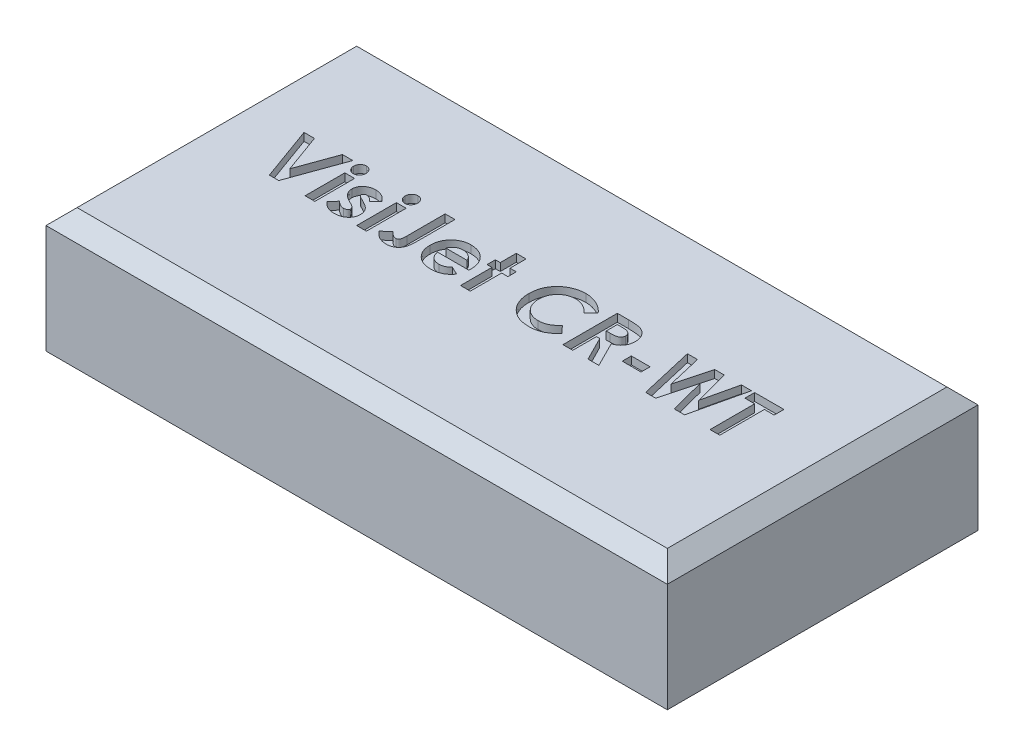
from build123d import *

# Parameters (mm, degrees)
SKETCH1_W           = 40
SKETCH1_H           = 20
BOSS_EXTRUDE1_DEPTH = 8
CHAMFER1_SIZE       = 1
SKETCH2_W           = 0.628205129
SKETCH2_H           = 2.557692308
SKETCH2_W_2         = 0.628205128
SKETCH2_W_3         = 1.211538462
SKETCH2_H_2         = 0.583333333
CUT_EXTRUDE1_DEPTH  = 0.5


with BuildPart() as part:
    # Sketch1 → Boss-Extrude1 (new body)
    with BuildSketch(Plane(origin=(0, 0, 0), x_dir=(1, 0, 0), z_dir=(0, 1, 0))):
        with Locations((0, 2.318501171)):
            Rectangle(SKETCH1_W, SKETCH1_H)
    extrude(amount=BOSS_EXTRUDE1_DEPTH)

    # Chamfer1
    chamfer1_edges = [part.edges().sort_by_distance(p)[0] for p in [
        (-20, 8, -2.318501171),
        (0, 8, 7.681498829),
        (20, 8, -2.318501171),
        (0, 8, -12.318501171),
    ]]
    chamfer(chamfer1_edges, length=CHAMFER1_SIZE)

    # Sketch2 → Cut-Extrude1 (cut)
    # profile 1 of 14: a face of its own
    with BuildSketch(Plane(origin=(0, 8, 0), x_dir=(1, 0, 0), z_dir=(0, 1, 0))):
        Polygon((-15.887820513, 4.818501171), (-15.216846955, 4.818501171), (-14.317307692, 2.332323286), (-13.415665064, 4.818501171), (-12.746794872, 4.818501171), (-14.015825321, 1.318501171), (-14.620893429, 1.318501171), align=None)
    # profile 2 of 14: a face of its own
    with BuildSketch(Plane(origin=(0, 8, 0), x_dir=(1, 0, 0), z_dir=(0, 1, 0))):
        with BuildLine():
            add(Edge.make_bspline(
                [(-12.0078125, 4.953116556), (-11.980736863, 4.951788122), (-11.927571242, 4.949179616), (-11.851404255, 4.923752479), (-11.781498398, 4.883845348), (-11.719699681, 4.829091813), (-11.668301287, 4.763706077), (-11.629031005, 4.690502399), (-11.607155167, 4.609395081), (-11.604116937, 4.553366994), (-11.602564103, 4.524731139)],
                knots=[0, 0, 0, 0, 0.989868614, 1.943702388, 2.910836514, 3.924849579, 4.949916355, 5.946401046, 6.950409252, 8, 8, 8, 8], degree=3))
            add(Edge.make_bspline(
                [(-11.602564103, 4.524731139), (-11.604061379, 4.496306314), (-11.606978893, 4.440919191), (-11.629534491, 4.360912942), (-11.6672286, 4.287744819), (-11.719043289, 4.223330183), (-11.780172027, 4.169458486), (-11.848550388, 4.128826865), (-11.923987474, 4.104814234), (-11.976328126, 4.101987671), (-12.002904647, 4.100552453)],
                knots=[0, 0, 0, 0, 1.05296456, 2.051751585, 3.055639087, 4.085634717, 5.099016424, 6.062201612, 7.016062274, 8, 8, 8, 8], degree=3))
            add(Edge.make_bspline(
                [(-12.002904647, 4.100552453), (-12.030216632, 4.101876137), (-12.083844792, 4.104475244), (-12.160636505, 4.129961874), (-12.231474728, 4.169554711), (-12.293005362, 4.225426946), (-12.344992383, 4.291277296), (-12.382547323, 4.36618522), (-12.406038867, 4.447847148), (-12.408827293, 4.504705048), (-12.41025641, 4.533845722)],
                knots=[0, 0, 0, 0, 0.989065327, 1.942068821, 2.907541208, 3.917690034, 4.939857478, 5.938239964, 6.943311734, 8, 8, 8, 8], degree=3))
            add(Edge.make_bspline(
                [(-12.41025641, 4.533845722), (-12.40870114, 4.561787876), (-12.405646036, 4.616676204), (-12.383639159, 4.695980268), (-12.345269344, 4.767953278), (-12.294241178, 4.832142067), (-12.232985262, 4.885874243), (-12.163121369, 4.924569368), (-12.087466989, 4.948946292), (-12.034638153, 4.951712114), (-12.0078125, 4.953116556)],
                knots=[0, 0, 0, 0, 1.038616768, 2.040212704, 3.031499824, 4.052181184, 5.074969369, 6.039807101, 7.004644834, 8, 8, 8, 8], degree=3))
        make_face()
    # profile 3 of 14: a face of its own
    with BuildSketch(Plane(origin=(0, 8, 0), x_dir=(1, 0, 0), z_dir=(0, 1, 0))):
        with Locations((-12.006410257, 2.597347325)):
            Rectangle(SKETCH2_W, SKETCH2_H)
    # profile 4 of 14: a face of its own
    with BuildSketch(Plane(origin=(0, 8, 0), x_dir=(1, 0, 0), z_dir=(0, 1, 0))):
        with BuildLine():
            Line((-9.538461538, 3.481461908), (-9.922676282, 3.068501171))
            add(Edge.make_bspline(
                [(-9.922676282, 3.068501171), (-9.941861965, 3.089731169), (-9.978556908, 3.130336114), (-10.03473332, 3.185689728), (-10.090073156, 3.231782937), (-10.143545162, 3.270503154), (-10.196241427, 3.300196932), (-10.247723927, 3.32156094), (-10.298017364, 3.33512313), (-10.33135398, 3.336878704), (-10.34755609, 3.33773194)],
                knots=[0, 0, 0, 0, 1.327646587, 2.539285, 3.655602211, 4.666613517, 5.598770349, 6.454635452, 7.248928967, 8, 8, 8, 8], degree=3))
            add(Edge.make_bspline(
                [(-10.34755609, 3.33773194), (-10.363950998, 3.33723228), (-10.395342146, 3.336275585), (-10.439642091, 3.328069544), (-10.478562556, 3.313863375), (-10.511496163, 3.294499043), (-10.537955605, 3.270644174), (-10.556481095, 3.243354767), (-10.568921132, 3.213479587), (-10.569973478, 3.192258092), (-10.570512821, 3.18138178)],
                knots=[0, 0, 0, 0, 1.295068245, 2.479652818, 3.543291146, 4.55379989, 5.481948265, 6.332409746, 7.145336708, 8, 8, 8, 8], degree=3))
            add(Edge.make_bspline(
                [(-10.570512821, 3.18138178), (-10.568685479, 3.164899466), (-10.564893959, 3.130700579), (-10.53885147, 3.091034972), (-10.504395376, 3.061774466), (-10.464677463, 3.034545884), (-10.410889127, 3.004101415), (-10.37008393, 2.983255198), (-10.34755609, 2.971746363)],
                knots=[0, 0, 0, 0, 0.916701701, 1.902049539, 2.5493345, 3.440293453, 4.586830489, 6, 6, 6, 6], degree=3))
            Line((-10.34755609, 2.971746363), (-10.120392628, 2.856762389))
            add(Edge.make_bspline(
                [(-10.120392628, 2.856762389), (-10.091493092, 2.842088143), (-10.035422565, 2.813617351), (-9.956592655, 2.767675903), (-9.883784094, 2.723146153), (-9.818457399, 2.677509175), (-9.76021273, 2.631557834), (-9.709463796, 2.584837732), (-9.664979678, 2.538829986), (-9.615373643, 2.477146177), (-9.56575272, 2.394988362), (-9.524384281, 2.288145952), (-9.498004131, 2.173741222), (-9.495085471, 2.094557347), (-9.493589744, 2.053977934)],
                knots=[0, 0, 0, 0, 1.076693506, 2.088987655, 3.030641824, 3.911722491, 4.735175175, 5.493635918, 6.202154166, 6.859459289, 8.120623445, 9.372284821, 10.653373066, 12, 12, 12, 12], degree=3))
            add(Edge.make_bspline(
                [(-9.493589744, 2.053977934), (-9.494490929, 2.026601336), (-9.496254788, 1.97301807), (-9.507405532, 1.89414861), (-9.527435157, 1.81915543), (-9.553794113, 1.746869538), (-9.589298837, 1.678598082), (-9.632403311, 1.614010106), (-9.6824269, 1.552257605), (-9.740692049, 1.495453011), (-9.804520546, 1.442511751), (-9.875476691, 1.39798435), (-9.950423114, 1.35883453), (-10.031339779, 1.328262007), (-10.117091324, 1.303475813), (-10.208412819, 1.286299602), (-10.30499439, 1.275490172), (-10.371130531, 1.274260174), (-10.405048077, 1.273629376)],
                knots=[0, 0, 0, 0, 0.976600749, 1.911466839, 2.833459288, 3.740827163, 4.650527853, 5.570709661, 6.506801416, 7.479409329, 8.468875524, 9.458587492, 10.461481786, 11.480119772, 12.538142914, 13.641687514, 14.790552763, 16, 16, 16, 16], degree=3))
            add(Edge.make_bspline(
                [(-10.405048077, 1.273629376), (-10.449985913, 1.275060396), (-10.538194928, 1.277869364), (-10.66701781, 1.297436227), (-10.788660809, 1.331306797), (-10.903224006, 1.378755132), (-11.011409084, 1.43921732), (-11.111671038, 1.514237659), (-11.205748001, 1.601861553), (-11.260482956, 1.669064999), (-11.288461538, 1.703417036)],
                knots=[0, 0, 0, 0, 1.056901255, 2.07460411, 3.05625841, 4.019970729, 4.984811261, 5.963335951, 6.958928997, 8, 8, 8, 8], degree=3))
            Line((-11.288461538, 1.703417036), (-10.907752404, 2.126193479))
            add(Edge.make_bspline(
                [(-10.907752404, 2.126193479), (-10.889202969, 2.106628595), (-10.852376275, 2.067785903), (-10.790301349, 2.016566561), (-10.724621682, 1.969883899), (-10.654606101, 1.930685695), (-10.584576372, 1.899034909), (-10.517388626, 1.875292392), (-10.454309088, 1.860371823), (-10.413296399, 1.858059996), (-10.393830128, 1.856962709)],
                knots=[0, 0, 0, 0, 1.087861918, 2.159761696, 3.243809206, 4.338405912, 5.394481878, 6.343674753, 7.213841449, 8, 8, 8, 8], degree=3))
            add(Edge.make_bspline(
                [(-10.393830128, 1.856962709), (-10.374374394, 1.857526161), (-10.336975103, 1.858609269), (-10.283821027, 1.869875723), (-10.23670812, 1.888816297), (-10.196754621, 1.915077883), (-10.16352237, 1.945222173), (-10.140106619, 1.979481335), (-10.124622886, 2.015809087), (-10.122741019, 2.041208069), (-10.121794872, 2.053977934)],
                knots=[0, 0, 0, 0, 1.255011871, 2.412479185, 3.488767498, 4.514443302, 5.48617286, 6.365347346, 7.178144445, 8, 8, 8, 8], degree=3))
            add(Edge.make_bspline(
                [(-10.121794872, 2.053977934), (-10.122639116, 2.06600345), (-10.124372512, 2.090694154), (-10.138095863, 2.127139399), (-10.159641794, 2.163226039), (-10.189524825, 2.199055819), (-10.228142587, 2.234338023), (-10.275356878, 2.268790052), (-10.330078462, 2.304249964), (-10.370498939, 2.325414783), (-10.391726763, 2.336530017)],
                knots=[0, 0, 0, 0, 0.704666567, 1.446816302, 2.258757648, 3.165368109, 4.175243826, 5.322435858, 6.59381024, 8, 8, 8, 8], degree=3))
            Line((-10.391726763, 2.336530017), (-10.599959936, 2.441698286))
            add(Edge.make_bspline(
                [(-10.599959936, 2.441698286), (-10.647195532, 2.467027903), (-10.737870167, 2.515651269), (-10.860428377, 2.59903001), (-10.964156208, 2.687788338), (-11.049138191, 2.781449415), (-11.116852003, 2.879750404), (-11.16408693, 2.983942869), (-11.193802014, 3.093039043), (-11.197071148, 3.167640191), (-11.198717949, 3.205219921)],
                knots=[0, 0, 0, 0, 1.255999728, 2.41104856, 3.467751088, 4.449286722, 5.368722015, 6.253902015, 7.120417131, 8, 8, 8, 8], degree=3))
            add(Edge.make_bspline(
                [(-11.198717949, 3.205219921), (-11.198146852, 3.22957557), (-11.197025697, 3.277389666), (-11.185090323, 3.34760798), (-11.167058534, 3.41510563), (-11.141613737, 3.47998981), (-11.109019397, 3.5423249), (-11.069085675, 3.601834263), (-11.021325384, 3.658409711), (-10.967267533, 3.711869002), (-10.90728865, 3.76055668), (-10.843102423, 3.803705348), (-10.774898705, 3.840459989), (-10.702117755, 3.869763404), (-10.625684659, 3.893087098), (-10.545094878, 3.908940882), (-10.460692244, 3.919023944), (-10.402974303, 3.920375189), (-10.373497596, 3.921065274)],
                knots=[0, 0, 0, 0, 0.959035663, 1.882742823, 2.798841253, 3.708806893, 4.623422363, 5.566085165, 6.527241613, 7.536786942, 8.55815439, 9.567237405, 10.580975912, 11.605536372, 12.654523293, 13.725718749, 14.838518481, 16, 16, 16, 16], degree=3))
            add(Edge.make_bspline(
                [(-10.373497596, 3.921065274), (-10.332745859, 3.919723558), (-10.251860848, 3.91706049), (-10.132571365, 3.895510926), (-10.017350099, 3.859291083), (-9.906520067, 3.809386196), (-9.801506891, 3.746669936), (-9.704619861, 3.670511216), (-9.615203278, 3.582785406), (-9.564296139, 3.515571795), (-9.538461538, 3.481461908)],
                knots=[0, 0, 0, 0, 0.996590028, 1.978055413, 2.954661574, 3.945146934, 4.945404762, 5.939399542, 6.954276554, 8, 8, 8, 8], degree=3))
        make_face()
    # profile 5 of 14: a face of its own
    with BuildSketch(Plane(origin=(0, 8, 0), x_dir=(1, 0, 0), z_dir=(0, 1, 0))):
        with BuildLine():
            add(Edge.make_bspline(
                [(-8.687299679, 4.953116556), (-8.660224043, 4.951788122), (-8.607058422, 4.949179616), (-8.530891435, 4.923752479), (-8.460985577, 4.883845348), (-8.39918686, 4.829091813), (-8.347788466, 4.763706077), (-8.308518185, 4.690502399), (-8.286642346, 4.609395081), (-8.283604116, 4.553366994), (-8.282051282, 4.524731139)],
                knots=[0, 0, 0, 0, 0.989868614, 1.943702388, 2.910836514, 3.924849579, 4.949916355, 5.946401046, 6.950409252, 8, 8, 8, 8], degree=3))
            add(Edge.make_bspline(
                [(-8.282051282, 4.524731139), (-8.283548558, 4.496306314), (-8.286466073, 4.440919191), (-8.30902167, 4.360912942), (-8.34671578, 4.287744819), (-8.398530468, 4.223330183), (-8.459659206, 4.169458486), (-8.528037567, 4.128826865), (-8.603474654, 4.104814234), (-8.655815305, 4.101987671), (-8.682391827, 4.100552453)],
                knots=[0, 0, 0, 0, 1.05296456, 2.051751585, 3.055639087, 4.085634717, 5.099016424, 6.062201612, 7.016062274, 8, 8, 8, 8], degree=3))
            add(Edge.make_bspline(
                [(-8.682391827, 4.100552453), (-8.709703811, 4.101876137), (-8.763331971, 4.104475244), (-8.840123684, 4.129961874), (-8.910961907, 4.169554711), (-8.972492542, 4.225426946), (-9.024479562, 4.291277296), (-9.062034503, 4.36618522), (-9.085526047, 4.447847148), (-9.088314473, 4.504705048), (-9.08974359, 4.533845722)],
                knots=[0, 0, 0, 0, 0.989065327, 1.942068821, 2.907541208, 3.917690034, 4.939857478, 5.938239964, 6.943311734, 8, 8, 8, 8], degree=3))
            add(Edge.make_bspline(
                [(-9.08974359, 4.533845722), (-9.08818832, 4.561787876), (-9.085133216, 4.616676204), (-9.063126339, 4.695980268), (-9.024756523, 4.767953278), (-8.973728357, 4.832142067), (-8.912472441, 4.885874243), (-8.842608549, 4.924569368), (-8.766954168, 4.948946292), (-8.714125333, 4.951712114), (-8.687299679, 4.953116556)],
                knots=[0, 0, 0, 0, 1.038616768, 2.040212704, 3.031499824, 4.052181184, 5.074969369, 6.039807101, 7.004644834, 8, 8, 8, 8], degree=3))
        make_face()
    # profile 6 of 14: a face of its own
    with BuildSketch(Plane(origin=(0, 8, 0), x_dir=(1, 0, 0), z_dir=(0, 1, 0))):
        with Locations((-8.685897436, 2.597347325)):
            Rectangle(SKETCH2_W_2, SKETCH2_H)
    # profile 7 of 14: a face of its own
    with BuildSketch(Plane(origin=(0, 8, 0), x_dir=(1, 0, 0), z_dir=(0, 1, 0))):
        with BuildLine():
            Line((-6.801282051, 4.818501171), (-6.173076923, 4.818501171))
            Line((-6.173076923, 4.818501171), (-6.173076923, 2.494983543))
            add(Edge.make_bspline(
                [(-6.173076923, 2.494983543), (-6.173307242, 2.450574837), (-6.173751021, 2.36500803), (-6.178194035, 2.241823414), (-6.184201775, 2.128881504), (-6.192853499, 2.026363272), (-6.205703678, 1.934273674), (-6.220246178, 1.852382955), (-6.236290593, 1.780357434), (-6.263393548, 1.69974967), (-6.305470098, 1.61048574), (-6.368964815, 1.514068012), (-6.44803606, 1.430297435), (-6.539100015, 1.357533007), (-6.642923963, 1.299917344), (-6.757116044, 1.258272588), (-6.881311212, 1.233393723), (-6.967331982, 1.230333232), (-7.01161859, 1.228757581)],
                knots=[0, 0, 0, 0, 1.22248561, 2.355488409, 3.392943897, 4.335991845, 5.186735882, 5.951517034, 6.625683685, 7.215700098, 8.28923535, 9.333114649, 10.380102123, 11.447198135, 12.530158036, 13.633358744, 14.781567393, 16, 16, 16, 16], degree=3))
            add(Edge.make_bspline(
                [(-7.01161859, 1.228757581), (-7.057761205, 1.230186103), (-7.14877246, 1.233003707), (-7.282249838, 1.257002456), (-7.410538284, 1.29547967), (-7.532974101, 1.351113105), (-7.651234697, 1.420801498), (-7.76317375, 1.507243167), (-7.871128394, 1.607757176), (-7.935124566, 1.684889104), (-7.967948718, 1.72445069)],
                knots=[0, 0, 0, 0, 0.990984786, 1.954608977, 2.90473533, 3.862451285, 4.837525908, 5.848096122, 6.896271184, 8, 8, 8, 8], degree=3))
            Line((-7.967948718, 1.72445069), (-7.492588141, 2.164054056))
            add(Edge.make_bspline(
                [(-7.492588141, 2.164054056), (-7.467698798, 2.135911237), (-7.421124145, 2.083248458), (-7.350937517, 2.014574901), (-7.287625396, 1.959403624), (-7.227943023, 1.919608085), (-7.171622199, 1.891556673), (-7.117451143, 1.871350452), (-7.063741264, 1.859912583), (-7.02825888, 1.857931117), (-7.010917468, 1.856962709)],
                knots=[0, 0, 0, 0, 1.529509877, 2.862124173, 3.996688592, 4.944357383, 5.774364335, 6.554177287, 7.293378699, 8, 8, 8, 8], degree=3))
            add(Edge.make_bspline(
                [(-7.010917468, 1.856962709), (-6.994132911, 1.857837997), (-6.961861726, 1.859520887), (-6.917487608, 1.878228347), (-6.880077372, 1.907599844), (-6.85544868, 1.941366192), (-6.839753685, 1.97588449), (-6.829947157, 2.009251732), (-6.820640744, 2.04925001), (-6.813184654, 2.09585928), (-6.807550819, 2.149687495), (-6.804742759, 2.210081183), (-6.801327799, 2.277366702), (-6.801297843, 2.324371477), (-6.801282051, 2.349150209)],
                knots=[0, 0, 0, 0, 1.003927327, 1.930222208, 2.840933547, 3.835773585, 4.407906147, 5.114514582, 5.922289074, 6.876303333, 7.950072246, 9.174518422, 10.510537432, 12, 12, 12, 12], degree=3))
            Line((-6.801282051, 2.349150209), (-6.801282051, 4.818501171))
        make_face()
    # profile 8 of 14: a face of its own
    with BuildSketch(Plane(origin=(0, 8, 0), x_dir=(1, 0, 0), z_dir=(0, 1, 0))):
        with BuildLine():
            Line((-2.899539263, 2.440296043), (-4.916666667, 2.440296043))
            add(Edge.make_bspline(
                [(-4.916666667, 2.440296043), (-4.912553907, 2.416858167), (-4.904472009, 2.370800891), (-4.886921881, 2.303898702), (-4.864525285, 2.240851208), (-4.837684376, 2.18157413), (-4.80685169, 2.125754094), (-4.770887917, 2.073652917), (-4.730249223, 2.025316619), (-4.685170572, 1.980955274), (-4.636403342, 1.941206548), (-4.584184036, 1.906384151), (-4.528458768, 1.877831916), (-4.469866406, 1.853765344), (-4.407969131, 1.834702181), (-4.342675845, 1.82155468), (-4.274159632, 1.813788403), (-4.227484294, 1.8126651), (-4.203625801, 1.812090915)],
                knots=[0, 0, 0, 0, 1.091296461, 2.144483647, 3.168565212, 4.157007626, 5.126487748, 6.090021542, 7.05641414, 8.019231907, 8.98705074, 9.938580405, 10.892824166, 11.854447369, 12.841318655, 13.858982407, 14.905600794, 16, 16, 16, 16], degree=3))
            add(Edge.make_bspline(
                [(-4.203625801, 1.812090915), (-4.174826981, 1.812851231), (-4.118113623, 1.814348519), (-4.035028131, 1.827627234), (-3.954672357, 1.847684151), (-3.877806751, 1.877510469), (-3.803540944, 1.914638993), (-3.73309758, 1.960896564), (-3.66525734, 2.014931387), (-3.623866799, 2.056581407), (-3.602764423, 2.077816075)],
                knots=[0, 0, 0, 0, 1.021034703, 2.010718019, 2.977989445, 3.954245119, 4.929443971, 5.918328161, 6.938689359, 8, 8, 8, 8], degree=3))
            Line((-3.602764423, 2.077816075), (-3.076923077, 1.827515594))
            add(Edge.make_bspline(
                [(-3.076923077, 1.827515594), (-3.093478885, 1.804638008), (-3.126283609, 1.759306914), (-3.179836221, 1.695514356), (-3.235721782, 1.635993312), (-3.29398197, 1.581135261), (-3.354690675, 1.531096525), (-3.41767902, 1.485267543), (-3.483867552, 1.444878805), (-3.551932846, 1.407976328), (-3.623281936, 1.376340006), (-3.697717368, 1.349361667), (-3.774923865, 1.324973478), (-3.85587638, 1.306391014), (-3.939900822, 1.291681287), (-4.027198192, 1.281235432), (-4.117756987, 1.274783528), (-4.179309272, 1.274018663), (-4.210637019, 1.273629376)],
                knots=[0, 0, 0, 0, 1.028154879, 2.037251081, 3.030720504, 4.000128189, 4.949298328, 5.894184978, 6.834267904, 7.770992897, 8.712077017, 9.673380525, 10.653304757, 11.658697181, 12.695551717, 13.758623199, 14.859225354, 16, 16, 16, 16], degree=3))
            add(Edge.make_bspline(
                [(-4.210637019, 1.273629376), (-4.258834244, 1.274611973), (-4.353225731, 1.276536331), (-4.491290345, 1.294397131), (-4.622413434, 1.324012264), (-4.746965244, 1.364269488), (-4.86440738, 1.417421635), (-4.974797965, 1.48243112), (-5.079239957, 1.558051581), (-5.174542071, 1.645870091), (-5.261365109, 1.741455317), (-5.337625067, 1.844107324), (-5.401438314, 1.953108919), (-5.453843035, 2.067738708), (-5.494573806, 2.188290097), (-5.523938328, 2.314815693), (-5.541939133, 2.447255065), (-5.543883309, 2.537461062), (-5.544871795, 2.583324889)],
                knots=[0, 0, 0, 0, 1.103565453, 2.161269334, 3.182010356, 4.179077853, 5.15417608, 6.128274628, 7.109042802, 8.101804412, 9.090965879, 10.063106201, 11.02526161, 11.978650795, 12.945248442, 13.93468508, 14.949922959, 16, 16, 16, 16], degree=3))
            add(Edge.make_bspline(
                [(-5.544871795, 2.583324889), (-5.54387358, 2.630354174), (-5.541909637, 2.722882182), (-5.524093315, 2.85837964), (-5.494492623, 2.987662542), (-5.453642706, 3.110908923), (-5.40203297, 3.228504247), (-5.337407809, 3.339419694), (-5.261402952, 3.444041412), (-5.174892693, 3.54187997), (-5.07918685, 3.630189957), (-4.977490349, 3.708891804), (-4.868660527, 3.774471407), (-4.753928342, 3.827459686), (-4.634027663, 3.870511324), (-4.507572605, 3.899158594), (-4.375525299, 3.918393521), (-4.285260669, 3.920164938), (-4.239383013, 3.921065274)],
                knots=[0, 0, 0, 0, 1.079208495, 2.12329425, 3.130605359, 4.119693003, 5.099659317, 6.073216462, 7.060498243, 8.06384408, 9.066070512, 10.045757761, 11.010926815, 11.975797609, 12.942977511, 13.929384301, 14.947594487, 16, 16, 16, 16], degree=3))
            add(Edge.make_bspline(
                [(-4.239383013, 3.921065274), (-4.19095489, 3.920067433), (-4.095871263, 3.918108276), (-3.956845072, 3.900392501), (-3.824851342, 3.870596779), (-3.699327704, 3.830687652), (-3.581877149, 3.776192825), (-3.469918929, 3.712783121), (-3.366138439, 3.635528066), (-3.269429489, 3.548139312), (-3.182129897, 3.451184518), (-3.105820381, 3.345861916), (-3.040890375, 3.233199394), (-2.98826396, 3.112740081), (-2.947575013, 2.984845607), (-2.918183308, 2.849682068), (-2.900319807, 2.706735368), (-2.898411808, 2.60885157), (-2.897435897, 2.558785626)],
                knots=[0, 0, 0, 0, 1.080001299, 2.120471247, 3.119684163, 4.095710327, 5.052285597, 6.002875087, 6.961153713, 7.931888285, 8.906493152, 9.865905668, 10.82813294, 11.801621613, 12.7925306, 13.817193356, 14.883530496, 16, 16, 16, 16], degree=3))
            Line((-2.897435897, 2.558785626), (-2.899539263, 2.440296043))
        make_face()
        with BuildLine():
            add(Edge.make_bspline(
                [(-3.525641026, 2.933885786), (-3.537495641, 2.96587659), (-3.561065703, 3.029482642), (-3.614309494, 3.117243473), (-3.684962301, 3.193247917), (-3.767136584, 3.260535254), (-3.861025847, 3.315149859), (-3.963671477, 3.354692608), (-4.073776051, 3.378402936), (-4.149522064, 3.381183741), (-4.188201122, 3.382603735)],
                knots=[0, 0, 0, 0, 0.954238005, 1.897273737, 2.851915805, 3.847685534, 4.862635127, 5.880135777, 6.917509367, 8, 8, 8, 8], degree=3))
            add(Edge.make_bspline(
                [(-4.188201122, 3.382603735), (-4.23044495, 3.381239658), (-4.313022839, 3.37857317), (-4.43213582, 3.350214097), (-4.544492115, 3.307889028), (-4.610731019, 3.264250982), (-4.643930288, 3.242379376)],
                knots=[0, 0, 0, 0, 1.044195649, 2.041185066, 3.018232172, 4, 4, 4, 4], degree=3))
            add(Edge.make_bspline(
                [(-4.643930288, 3.242379376), (-4.664644153, 3.225721482), (-4.708805053, 3.190207702), (-4.766156942, 3.119361084), (-4.822649029, 3.033581734), (-4.854767895, 2.968426257), (-4.871794872, 2.933885786)],
                knots=[0, 0, 0, 0, 0.82159062, 1.751589201, 2.808063854, 4, 4, 4, 4], degree=3))
            Line((-4.871794872, 2.933885786), (-3.525641026, 2.933885786))
        make_face(mode=Mode.SUBTRACT)
    # profile 9 of 14: a face of its own
    with BuildSketch(Plane(origin=(0, 8, 0), x_dir=(1, 0, 0), z_dir=(0, 1, 0))):
        Polygon((-2.314102564, 4.908244761), (-1.685897436, 4.908244761), (-1.685897436, 3.876193479), (-1.282051282, 3.876193479), (-1.282051282, 3.33773194), (-1.685897436, 3.33773194), (-1.685897436, 1.318501171), (-2.314102564, 1.318501171), (-2.314102564, 3.33773194), (-2.628205128, 3.33773194), (-2.628205128, 3.876193479), (-2.314102564, 3.876193479), align=None)
    # profile 10 of 14: a face of its own
    with BuildSketch(Plane(origin=(0, 8, 0), x_dir=(1, 0, 0), z_dir=(0, 1, 0))):
        with BuildLine():
            Line((3.653846154, 4.211329697), (3.193209135, 3.771025209))
            add(Edge.make_bspline(
                [(3.193209135, 3.771025209), (3.15413415, 3.811428809), (3.077808463, 3.890349697), (2.954819058, 3.994833998), (2.826914555, 4.081907526), (2.696583081, 4.155240296), (2.56148035, 4.210721764), (2.423168517, 4.251152043), (2.280764422, 4.275800857), (2.184390808, 4.278621117), (2.135917468, 4.280039632)],
                knots=[0, 0, 0, 0, 1.115251505, 2.178435587, 3.19620269, 4.182487026, 5.141301733, 6.088180966, 7.038406374, 8, 8, 8, 8], degree=3))
            add(Edge.make_bspline(
                [(2.135917468, 4.280039632), (2.095436339, 4.278918956), (2.01555129, 4.276707424), (1.898259105, 4.260494714), (1.786063069, 4.232924295), (1.678579115, 4.19492715), (1.576123522, 4.145760861), (1.478481477, 4.085463482), (1.385893713, 4.014579584), (1.299583261, 3.933475923), (1.220629493, 3.844864078), (1.150868811, 3.750315452), (1.09243305, 3.650046649), (1.044475772, 3.545073118), (1.007118906, 3.434908989), (0.98044141, 3.31962843), (0.965011859, 3.199094151), (0.962708896, 3.117155846), (0.961538462, 3.075512389)],
                knots=[0, 0, 0, 0, 1.035432265, 2.043311493, 3.022114605, 3.98653278, 4.95457646, 5.923598177, 6.917315552, 7.932509744, 8.948865224, 9.949768934, 10.933144597, 11.912367597, 12.897413939, 13.903909035, 14.934704909, 16, 16, 16, 16], degree=3))
            add(Edge.make_bspline(
                [(0.961538462, 3.075512389), (0.961875767, 3.046284097), (0.962540604, 2.988674533), (0.969818415, 2.903453999), (0.981537407, 2.820769935), (0.998497693, 2.740747583), (1.019706696, 2.663317596), (1.044589687, 2.587811991), (1.075805032, 2.515274083), (1.110454537, 2.444861392), (1.150751511, 2.378495218), (1.194199083, 2.315209562), (1.241310882, 2.255314646), (1.292392052, 2.199055321), (1.348161499, 2.147310795), (1.407177788, 2.098525048), (1.470436443, 2.053919353), (1.53662342, 2.012374281), (1.606310492, 1.976283723), (1.677606887, 1.94359265), (1.751593602, 1.917042638), (1.827369803, 1.895640906), (1.904664695, 1.87744193), (1.984234292, 1.866236261), (2.065388826, 1.857750339), (2.12023567, 1.857226383), (2.147836538, 1.856962709)],
                knots=[0, 0, 0, 0, 1.103660481, 2.175337485, 3.227646561, 4.255952547, 5.262355991, 6.258840057, 7.255597736, 8.242457506, 9.22035537, 10.185017736, 11.140346927, 12.096287581, 13.051739095, 14.01125915, 14.986044842, 15.97314143, 16.960198552, 17.947847494, 18.933482797, 19.925264591, 20.920966487, 21.929612487, 22.958107872, 24, 24, 24, 24], degree=3))
            add(Edge.make_bspline(
                [(2.147836538, 1.856962709), (2.194652355, 1.858316871), (2.286633262, 1.860977447), (2.421628467, 1.881782774), (2.55026545, 1.91600636), (2.653045783, 1.956422426), (2.733571459, 1.996333816), (2.794874466, 2.033249886), (2.858266553, 2.074544563), (2.922694832, 2.121776354), (2.988883993, 2.174378458), (3.055665645, 2.233502959), (3.12474941, 2.297202972), (3.1700055, 2.342666923), (3.193209135, 2.365977132)],
                knots=[0, 0, 0, 0, 1.404581149, 2.759636711, 4.088442092, 5.392261763, 6.066678138, 6.783632037, 7.538459478, 8.336747902, 9.180226004, 10.074962426, 11.012997595, 12, 12, 12, 12], degree=3))
            Line((3.193209135, 2.365977132), (3.639823718, 1.896926652))
            add(Edge.make_bspline(
                [(3.639823718, 1.896926652), (3.608429117, 1.86661615), (3.547153569, 1.807456532), (3.454721106, 1.723455396), (3.362404973, 1.647971036), (3.272435336, 1.578263703), (3.183338398, 1.516364139), (3.095123606, 1.462210526), (3.008789593, 1.414433239), (2.922543603, 1.37383802), (2.83584897, 1.339368462), (2.746650381, 1.309692436), (2.654675147, 1.284587585), (2.559361526, 1.264331267), (2.461598544, 1.248088435), (2.360471271, 1.237124617), (2.256620902, 1.229754008), (2.186177588, 1.229091697), (2.150641026, 1.228757581)],
                knots=[0, 0, 0, 0, 1.244526981, 2.429050516, 3.560637417, 4.644440555, 5.67424972, 6.652764056, 7.595344123, 8.486817594, 9.369275933, 10.254498637, 11.166417451, 12.086725134, 13.032340136, 13.991389299, 14.986715468, 16, 16, 16, 16], degree=3))
            add(Edge.make_bspline(
                [(2.150641026, 1.228757581), (2.085364762, 1.230421603), (1.957637258, 1.233677632), (1.770455931, 1.257802601), (1.592638695, 1.298247686), (1.423752955, 1.355448193), (1.26385241, 1.428519159), (1.11297797, 1.518100732), (0.97137281, 1.623954908), (0.840180821, 1.744840974), (0.721511423, 1.878349485), (0.616621418, 2.021700999), (0.529856402, 2.175600037), (0.457813539, 2.337773017), (0.401476968, 2.508959999), (0.361825573, 2.689346153), (0.337372847, 2.878757307), (0.334697684, 3.008129492), (0.333333333, 3.074110145)],
                knots=[0, 0, 0, 0, 1.078019885, 2.10938526, 3.111377082, 4.085535484, 5.04941344, 6.010039228, 6.978205633, 7.964457913, 8.951525778, 9.924444315, 10.892603023, 11.863865945, 12.85144698, 13.863884204, 14.910567087, 16, 16, 16, 16], degree=3))
            add(Edge.make_bspline(
                [(0.333333333, 3.074110145), (0.333909842, 3.117142165), (0.33505234, 3.202421109), (0.347060108, 3.328043904), (0.363799634, 3.450503658), (0.39035537, 3.568528834), (0.42236569, 3.683709448), (0.462174729, 3.794793622), (0.509718906, 3.902100622), (0.56346576, 4.005810088), (0.624269039, 4.105242611), (0.692192976, 4.199543908), (0.765488945, 4.28944197), (0.845918128, 4.37374413), (0.932311784, 4.453190578), (1.02505997, 4.527350779), (1.123604853, 4.597288274), (1.228213156, 4.661199544), (1.33685262, 4.719010685), (1.448153013, 4.77000258), (1.561840886, 4.812620062), (1.677435554, 4.847969692), (1.795425403, 4.87435569), (1.914968253, 4.89432904), (2.03708127, 4.90549427), (2.119069581, 4.90732209), (2.160456731, 4.908244761)],
                knots=[0, 0, 0, 0, 1.071919942, 2.124283339, 3.142214191, 4.149696895, 5.136002878, 6.119640489, 7.086990633, 8.058538607, 9.028339693, 9.988281803, 10.952401235, 11.916291999, 12.888973767, 13.874849856, 14.873389453, 15.898127285, 16.927174885, 17.938320013, 18.946391617, 19.950418109, 20.947802303, 21.956882652, 22.968648068, 24, 24, 24, 24], degree=3))
            add(Edge.make_bspline(
                [(2.160456731, 4.908244761), (2.195764213, 4.907715863), (2.266012078, 4.906663566), (2.370622937, 4.897891525), (2.474397167, 4.884115124), (2.576963225, 4.863329469), (2.679054768, 4.83865427), (2.779330199, 4.8063455), (2.879371417, 4.770331288), (2.977609424, 4.72728365), (3.074181345, 4.680293266), (3.166824832, 4.626980968), (3.25709536, 4.570627536), (3.342992589, 4.507897727), (3.426125557, 4.441066868), (3.506059557, 4.369823155), (3.58209312, 4.292978747), (3.629807562, 4.238683637), (3.653846154, 4.211329697)],
                knots=[0, 0, 0, 0, 0.996412454, 1.982464992, 2.961075852, 3.949442424, 4.934965278, 5.923860011, 6.921385422, 7.934793307, 8.949617135, 9.951082467, 10.950285876, 11.951772932, 12.951063433, 13.960125323, 14.972308753, 16, 16, 16, 16], degree=3))
        make_face()
    # profile 11 of 14: a face of its own
    with BuildSketch(Plane(origin=(0, 8, 0), x_dir=(1, 0, 0), z_dir=(0, 1, 0))):
        with BuildLine():
            Line((4.282051282, 4.818501171), (5.014022436, 4.818501171))
            add(Edge.make_bspline(
                [(5.014022436, 4.818501171), (5.062405506, 4.818329439), (5.15545978, 4.81799915), (5.289638959, 4.81278806), (5.412900988, 4.805536401), (5.525428367, 4.794470177), (5.627172956, 4.779797701), (5.718236725, 4.76250128), (5.798617013, 4.742788301), (5.868991717, 4.718224373), (5.932501408, 4.690516634), (5.991701269, 4.658679935), (6.047897337, 4.623068786), (6.100714004, 4.582746162), (6.150610257, 4.538437457), (6.197680229, 4.49009807), (6.241258777, 4.437318103), (6.281076063, 4.380431058), (6.317366313, 4.320587191), (6.349439283, 4.257704336), (6.375521076, 4.191738763), (6.398567135, 4.123643816), (6.415166466, 4.052446065), (6.426711057, 3.978838632), (6.435163555, 3.902562411), (6.435649533, 3.850743733), (6.435897436, 3.824310466)],
                knots=[0, 0, 0, 0, 1.749336639, 3.364467119, 4.854658419, 6.213483162, 7.451590619, 8.570285859, 9.5643256, 10.440900261, 11.26203566, 12.067320669, 12.869050712, 13.665104639, 14.467235401, 15.27997916, 16.102287765, 16.939272006, 17.78853747, 18.631303466, 19.488103222, 20.351255419, 21.228522269, 22.127379805, 23.044756219, 24, 24, 24, 24], degree=3))
            add(Edge.make_bspline(
                [(6.435897436, 3.824310466), (6.435253474, 3.796720207), (6.433990781, 3.742620739), (6.427189233, 3.663153032), (6.414758139, 3.587123888), (6.395929438, 3.514755912), (6.374288292, 3.4451484), (6.34551112, 3.379585653), (6.313033236, 3.317114157), (6.274460203, 3.258617595), (6.232128184, 3.20279664), (6.182896936, 3.151790002), (6.129955887, 3.102856265), (6.07032903, 3.059060474), (6.006644771, 3.017441316), (5.93763777, 2.979723274), (5.863758392, 2.944958206), (5.81181753, 2.925570802), (5.78525641, 2.91565662)],
                knots=[0, 0, 0, 0, 1.099860209, 2.156625411, 3.176576793, 4.16617041, 5.135385252, 6.078461593, 7.016046972, 7.938469504, 8.868247731, 9.803980173, 10.76021508, 11.73834243, 12.748633912, 13.790971185, 14.870363756, 16, 16, 16, 16], degree=3))
            Line((5.78525641, 2.91565662), (6.592948718, 1.318501171))
            Line((6.592948718, 1.318501171), (5.89463141, 1.318501171))
            Line((5.89463141, 1.318501171), (5.123397436, 2.844142197))
            Line((5.123397436, 2.844142197), (4.91025641, 2.844142197))
            Line((4.91025641, 2.844142197), (4.91025641, 1.318501171))
            Line((4.91025641, 1.318501171), (4.282051282, 1.318501171))
            Line((4.282051282, 1.318501171), (4.282051282, 4.818501171))
        make_face()
        with BuildLine():
            Line((4.91025641, 3.472347325), (5.154947917, 3.472347325))
            add(Edge.make_bspline(
                [(5.154947917, 3.472347325), (5.184863487, 3.472684254), (5.242145377, 3.473329401), (5.324524258, 3.476321861), (5.399343928, 3.483532211), (5.466925689, 3.492642218), (5.527609604, 3.503161037), (5.580854397, 3.518235143), (5.627480486, 3.534387429), (5.666935352, 3.554460531), (5.700644683, 3.577288002), (5.729750533, 3.603220576), (5.753825244, 3.633234229), (5.773639959, 3.666513318), (5.789053653, 3.70335219), (5.800304469, 3.743346436), (5.806592011, 3.786951643), (5.807315414, 3.817045173), (5.807692308, 3.832723927)],
                knots=[0, 0, 0, 0, 1.688639943, 3.233382647, 4.650958383, 5.928841754, 7.082724185, 8.122798841, 9.049171256, 9.863274652, 10.613301712, 11.341792392, 12.054588806, 12.776240173, 13.521029143, 14.301969904, 15.115324896, 16, 16, 16, 16], degree=3))
            add(Edge.make_bspline(
                [(5.807692308, 3.832723927), (5.806979756, 3.851273039), (5.805580079, 3.88770933), (5.791690942, 3.940164814), (5.769582435, 3.988715953), (5.739277728, 4.033143381), (5.701112889, 4.072091531), (5.657315725, 4.106424636), (5.606940988, 4.133572687), (5.560297772, 4.151479252), (5.517863348, 4.162192934), (5.479567619, 4.170176676), (5.435220935, 4.175834983), (5.384789815, 4.181836624), (5.328402811, 4.185728385), (5.26575258, 4.188568594), (5.197019052, 4.189730664), (5.149105255, 4.190102157), (5.124098558, 4.190296043)],
                knots=[0, 0, 0, 0, 1.020303359, 2.004196876, 2.966617323, 3.9489082, 4.950758222, 5.960522915, 7.003732012, 8.091992268, 8.70421221, 9.413913587, 10.24622431, 11.166358409, 12.212345909, 13.359657661, 14.621978493, 16, 16, 16, 16], degree=3))
            Line((5.124098558, 4.190296043), (4.91025641, 4.190296043))
            Line((4.91025641, 4.190296043), (4.91025641, 3.472347325))
        make_face(mode=Mode.SUBTRACT)
    # profile 12 of 14: a face of its own
    with BuildSketch(Plane(origin=(0, 8, 0), x_dir=(1, 0, 0), z_dir=(0, 1, 0))):
        with Locations((7.71474359, 2.597347325)):
            Rectangle(SKETCH2_W_3, SKETCH2_H_2)
    # profile 13 of 14: a face of its own
    with BuildSketch(Plane(origin=(0, 8, 0), x_dir=(1, 0, 0), z_dir=(0, 1, 0))):
        Polygon((8.791666667, 4.818501171), (9.440204327, 4.818501171), (9.958333333, 2.584026011), (10.552183494, 4.818501171), (11.162860577, 4.818501171), (11.753205128, 2.584026011), (12.269931891, 4.818501171), (12.919871795, 4.818501171), (12.110076122, 1.318501171), (11.453826122, 1.318501171), (10.855769231, 3.581021203), (10.254206731, 1.318501171), (9.602864583, 1.318501171), align=None)
    # profile 14 of 14: a face of its own
    with BuildSketch(Plane(origin=(0, 8, 0), x_dir=(1, 0, 0), z_dir=(0, 1, 0))):
        Polygon((13.121794872, 4.818501171), (15.006410256, 4.818501171), (15.006410256, 4.190296043), (14.378205128, 4.190296043), (14.378205128, 1.318501171), (13.75, 1.318501171), (13.75, 4.190296043), (13.121794872, 4.190296043), align=None)
    extrude(amount=-CUT_EXTRUDE1_DEPTH, mode=Mode.SUBTRACT)


solid = part.part
